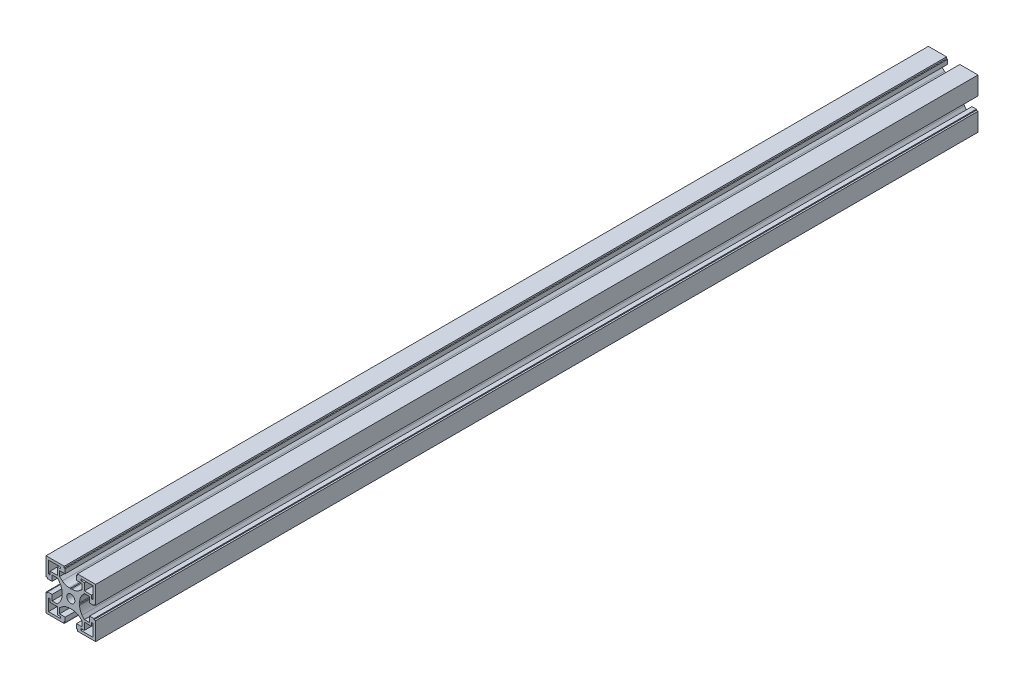
from build123d import *

# Parameters (mm, degrees)
MODEL_R             = 3.7
BOSS_EXTRUDE1_DEPTH = 800


with BuildPart() as part:
    # Model → Boss-Extrude1 (new body)
    with BuildSketch(Plane.XY):
        with BuildLine():
            Line((0.5, 8), (1.472732261, 8))
            ThreePointArc((1.472732261, 8), (4.799135414, 8.56946226), (7.746686356, 10.212991588))
            Line((7.746686356, 10.212991588), (10.25, 12.229898987))
            Line((10.25, 12.229898987), (10.25, 17))
            Line((10.25, 17), (5.1, 17))
            Line((5.1, 17), (5.1, 21))
            Line((5.1, 21), (5.999986755, 21))
            Line((5.999986755, 21), (5.999986755, 22.5))
            Line((5.999986755, 22.5), (22.5, 22.5))
            Line((22.5, 22.5), (22.5, 5.999986755))
            Line((22.5, 5.999986755), (21, 5.999986755))
            Line((21, 5.999986755), (21, 5.1))
            Line((21, 5.1), (17, 5.1))
            Line((17, 5.1), (17, 10.25))
            Line((17, 10.25), (12.229898987, 10.25))
            Line((12.229898987, 10.25), (10.212991588, 7.746686356))
            ThreePointArc((10.212991588, 7.746686356), (8.56946226, 4.799135414), (8, 1.472732261))
            Line((8, 1.472732261), (8, 0.5))
            Line((8, 0.5), (7.5, 0))
            Line((7.5, 0), (8, -0.5))
            Line((8, -0.5), (8, -1.472732261))
            ThreePointArc((8, -1.472732261), (8.56946226, -4.799135414), (10.212991588, -7.746686356))
            Line((10.212991588, -7.746686356), (12.229898987, -10.25))
            Line((12.229898987, -10.25), (17, -10.25))
            Line((17, -10.25), (17, -5.1))
            Line((17, -5.1), (21, -5.1))
            Line((21, -5.1), (21, -6.000013245))
            Line((21, -6.000013245), (22.5, -6.000013245))
            Line((22.5, -6.000013245), (22.5, -22.5))
            Line((22.5, -22.5), (6.000013245, -22.5))
            Line((6.000013245, -22.5), (6.000013245, -21))
            Line((6.000013245, -21), (5.1, -21))
            Line((5.1, -21), (5.1, -17))
            Line((5.1, -17), (10.25, -17))
            Line((10.25, -17), (10.25, -12.229898987))
            Line((10.25, -12.229898987), (7.746686356, -10.212991588))
            ThreePointArc((7.746686356, -10.212991588), (4.799135414, -8.56946226), (1.472732261, -8))
            Line((1.472732261, -8), (0.5, -8))
            Line((0.5, -8), (0, -7.5))
            Line((0, -7.5), (-0.5, -8))
            Line((-0.5, -8), (-1.472732261, -8))
            ThreePointArc((-1.472732261, -8), (-4.799135414, -8.56946226), (-7.746686356, -10.212991588))
            Line((-7.746686356, -10.212991588), (-10.25, -12.229898987))
            Line((-10.25, -12.229898987), (-10.25, -17))
            Line((-10.25, -17), (-5.1, -17))
            Line((-5.1, -17), (-5.1, -21))
            Line((-5.1, -21), (-5.999986755, -21))
            Line((-5.999986755, -21), (-5.999986755, -22.5))
            Line((-5.999986755, -22.5), (-22.5, -22.5))
            Line((-22.5, -22.5), (-22.5, -5.999986755))
            Line((-22.5, -5.999986755), (-21, -5.999986755))
            Line((-21, -5.999986755), (-21, -5.1))
            Line((-21, -5.1), (-17, -5.1))
            Line((-17, -5.1), (-17, -10.25))
            Line((-17, -10.25), (-12.229898987, -10.25))
            Line((-12.229898987, -10.25), (-10.212991588, -7.746686356))
            ThreePointArc((-10.212991588, -7.746686356), (-8.56946226, -4.799135414), (-8, -1.472732261))
            Line((-8, -1.472732261), (-8, -0.5))
            Line((-8, -0.5), (-7.5, 0))
            Line((-7.5, 0), (-8, 0.5))
            Line((-8, 0.5), (-8, 1.472732261))
            ThreePointArc((-8, 1.472732261), (-8.56946226, 4.799135414), (-10.212991588, 7.746686356))
            Line((-10.212991588, 7.746686356), (-12.229898987, 10.25))
            Line((-12.229898987, 10.25), (-17, 10.25))
            Line((-17, 10.25), (-17, 5.1))
            Line((-17, 5.1), (-21, 5.1))
            Line((-21, 5.1), (-21, 6.000013245))
            Line((-21, 6.000013245), (-22.5, 6.000013245))
            Line((-22.5, 6.000013245), (-22.5, 22.5))
            Line((-22.5, 22.5), (-6.000013245, 22.5))
            Line((-6.000013245, 22.5), (-6.000013245, 21))
            Line((-6.000013245, 21), (-5.1, 21))
            Line((-5.1, 21), (-5.1, 17))
            Line((-5.1, 17), (-10.25, 17))
            Line((-10.25, 17), (-10.25, 12.229898987))
            Line((-10.25, 12.229898987), (-7.746686356, 10.212991588))
            ThreePointArc((-7.746686356, 10.212991588), (-4.799135414, 8.56946226), (-1.472732261, 8))
            Line((-1.472732261, 8), (-0.5, 8))
            Line((-0.5, 8), (0, 7.5))
            Line((0, 7.5), (0.5, 8))
        make_face()
        Circle(MODEL_R, mode=Mode.SUBTRACT)
        Polygon((20.25, -9.25), (20.25, -20.25), (9.25, -20.25), (9.25, -18.75), (12.25, -18.75), (12.25, -12.25), (18.75, -12.25), (18.75, -9.25), align=None, mode=Mode.SUBTRACT)
        Polygon((9.25, 20.25), (20.25, 20.25), (20.25, 9.25), (18.75, 9.25), (18.75, 12.25), (12.25, 12.25), (12.25, 18.75), (9.25, 18.75), align=None, mode=Mode.SUBTRACT)
        Polygon((-9.25, -20.25), (-20.25, -20.25), (-20.25, -9.25), (-18.75, -9.25), (-18.75, -12.25), (-12.25, -12.25), (-12.25, -18.75), (-9.25, -18.75), align=None, mode=Mode.SUBTRACT)
        Polygon((-20.25, 20.25), (-9.25, 20.25), (-9.25, 18.75), (-12.25, 18.75), (-12.25, 12.25), (-18.75, 12.25), (-18.75, 9.25), (-20.25, 9.25), align=None, mode=Mode.SUBTRACT)
    extrude(amount=-BOSS_EXTRUDE1_DEPTH)


solid = part.part
